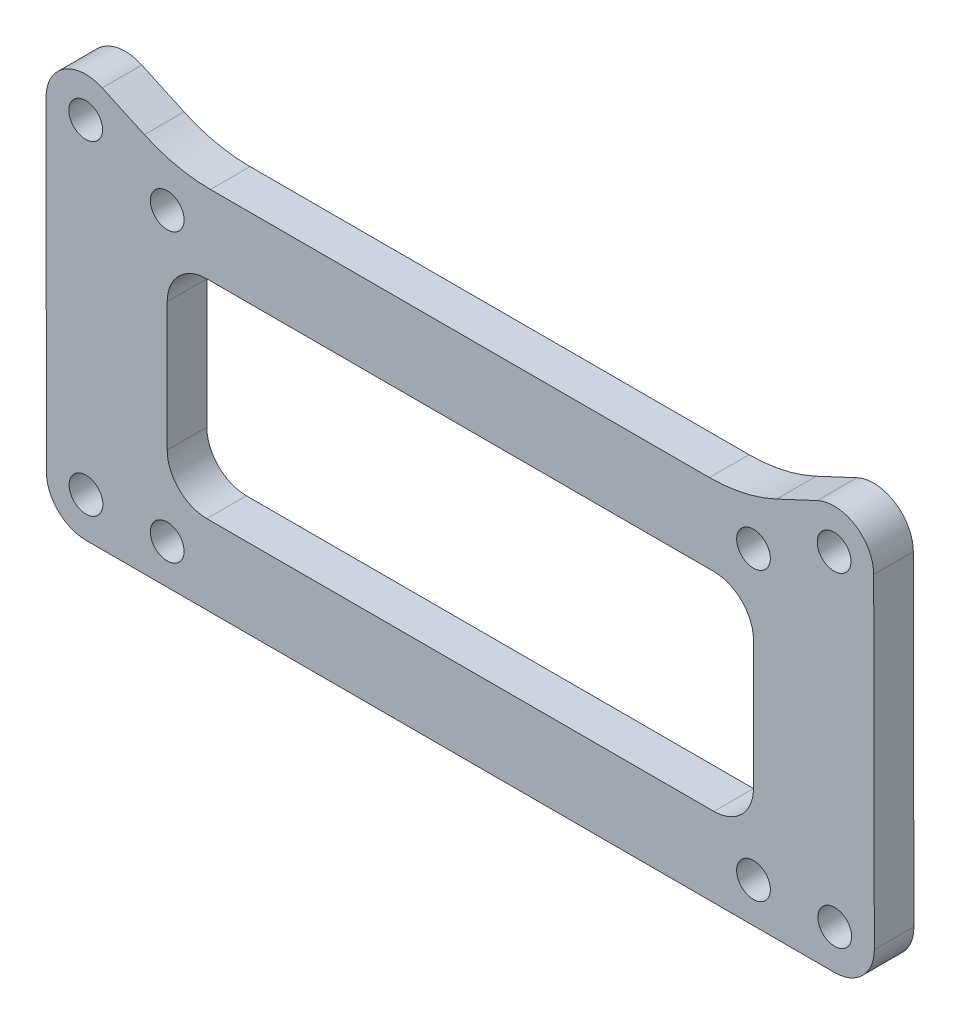
from build123d import *

# Parameters (mm, degrees)
SKETCH2_W             = 47
SKETCH2_H             = 16.65
BOSS_EXTRUDE1_DEPTH   = 3.175
FILLET1_R             = 3.175
FILLET2_R             = 12.7
F_2_CLEARANCE_HOLE1_D = 2.7051
F_2_CLEARANCE_HOLE2_D = 2.7051


with BuildPart() as part:
    # Sketch2 → Boss-Extrude1 (new body)
    with BuildSketch(Plane.XY):
        with BuildLine():
            Line((58.628990163, 28.900566469), (52.80618907, 26.175))
            Line((52.80618907, 26.175), (7.206212285, 26.175))
            Line((7.206212285, 26.175), (1.299208473, 28.885670965))
            ThreePointArc((1.299208473, 28.885670965), (-1.739097882, 28.672544378), (-3.2, 26))
            Line((-3.2, 26), (-3.175, 0))
            ThreePointArc((-3.175, 0), (-2.24506403, -2.24506403), (0, -3.175))
            Line((0, -3.175), (60.025, -3.175))
            ThreePointArc((60.025, -3.175), (62.272219886, -2.242906103), (63.199994139, 0.006100608))
            Line((63.199994139, 0.006100608), (63.15, 26.025))
            ThreePointArc((63.15, 26.025), (61.678972384, 28.704011593), (58.628990163, 28.900566469))
        make_face()
        with Locations((30.0125, 11.5)):
            Rectangle(SKETCH2_W, SKETCH2_H, mode=Mode.SUBTRACT)
    extrude(amount=BOSS_EXTRUDE1_DEPTH)

    # Fillet1
    fillet1_edges = [part.edges().sort_by_distance(p)[0] for p in [
        (6.5125, 3.175, 1.5875),
        (53.5125, 3.175, 1.5875),
        (53.5125, 19.825, 1.5875),
        (6.5125, 19.825, 1.5875),
    ]]
    fillet(fillet1_edges, radius=FILLET1_R)

    # Fillet2
    fillet2_edges = [part.edges().sort_by_distance(p)[0] for p in [
        (7.206212285, 26.175, 1.5875),
        (52.80618907, 26.175, 1.5875),
    ]]
    fillet(fillet2_edges, radius=FILLET2_R)

    # #2 Clearance Hole1 (through all)
    with Locations(Plane.XY.offset(3.175)):
        with Locations((6.5125, 23), (53.5125, 23), (53.5125, 0), (6.5125, 0)):
            Hole(F_2_CLEARANCE_HOLE1_D / 2)

    # #2 Clearance Hole2 (through all)
    with Locations(Plane.XY.offset(3.175)):
        with Locations((-0.025, 26), (0, 0), (60.025, 0), (59.975, 26.025)):
            Hole(F_2_CLEARANCE_HOLE2_D / 2)


solid = part.part
